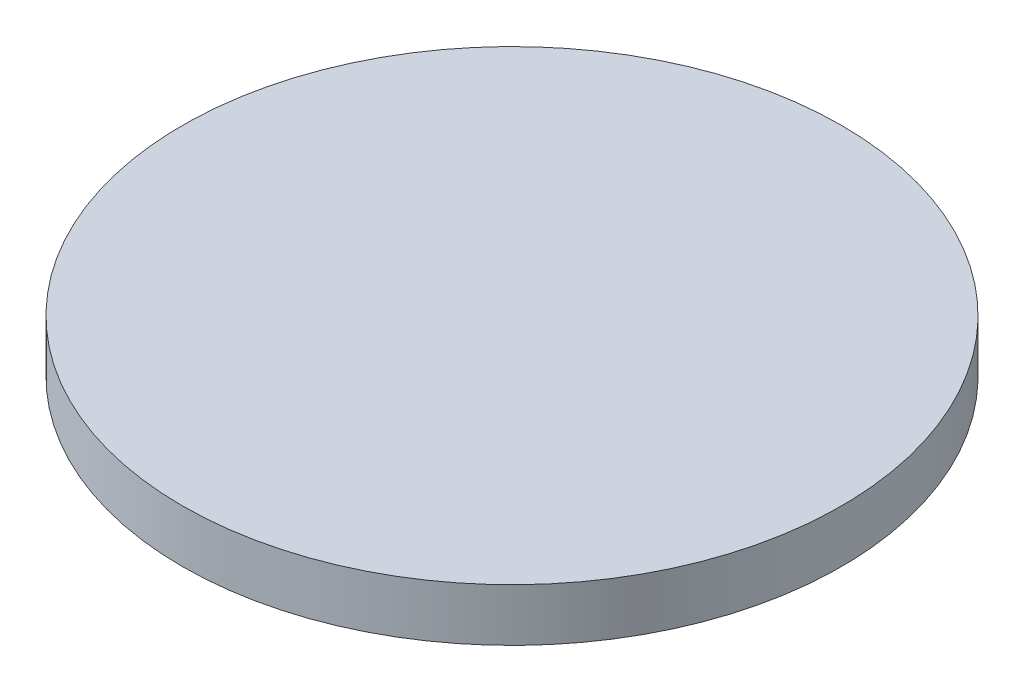
from build123d import *

# Parameters (mm, degrees)
SKETCH1_R           = 9.525
BOSS_EXTRUDE1_DEPTH = 1.52


with BuildPart() as part:
    # Sketch1 → Boss-Extrude1 (new body)
    with BuildSketch(Plane(origin=(0, 0, 0), x_dir=(1, 0, 0), z_dir=(0, 1, 0))):
        with Locations(Location((0, 0, 0), (0, 0, 270))):
            Circle(SKETCH1_R)
    extrude(amount=BOSS_EXTRUDE1_DEPTH)


solid = part.part
